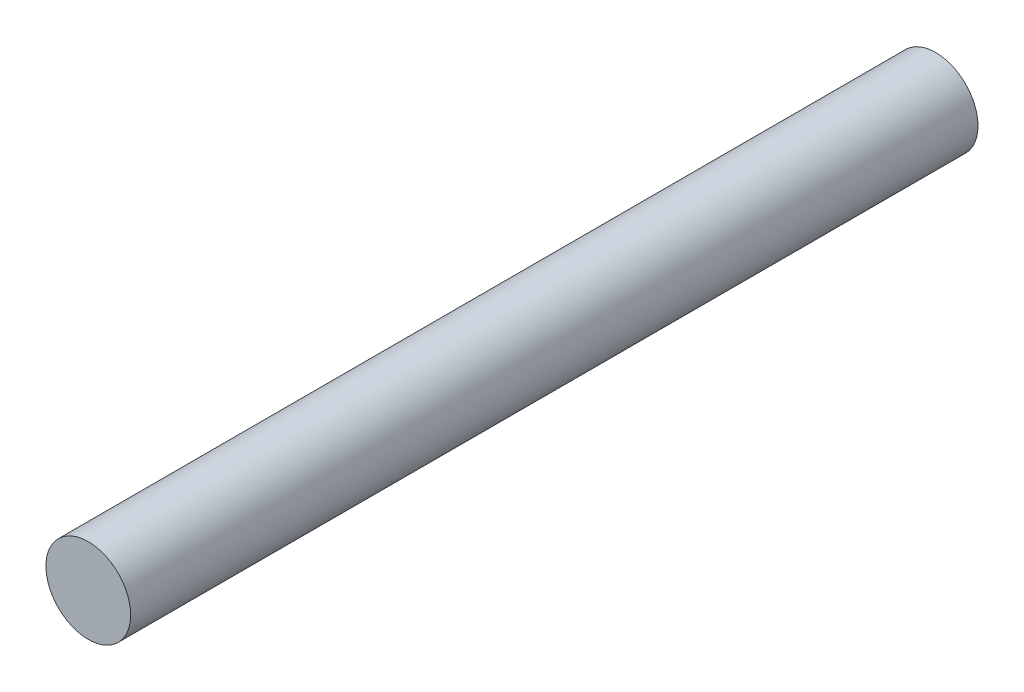
from build123d import *

# Parameters (mm, degrees)
SKETCH1_W = 63.5
SKETCH1_H = 1270


with BuildPart() as part:
    # Sketch1 → Revolve1 (revolve)
    with BuildSketch(Plane(origin=(0, 0, 0), x_dir=(1, 0, 0), z_dir=(0, 1, 0))):
        with Locations((31.75, -635)):
            Rectangle(SKETCH1_W, SKETCH1_H)
    revolve(axis=Axis((0, 0, 0), (0, 0, 1)))


solid = part.part
